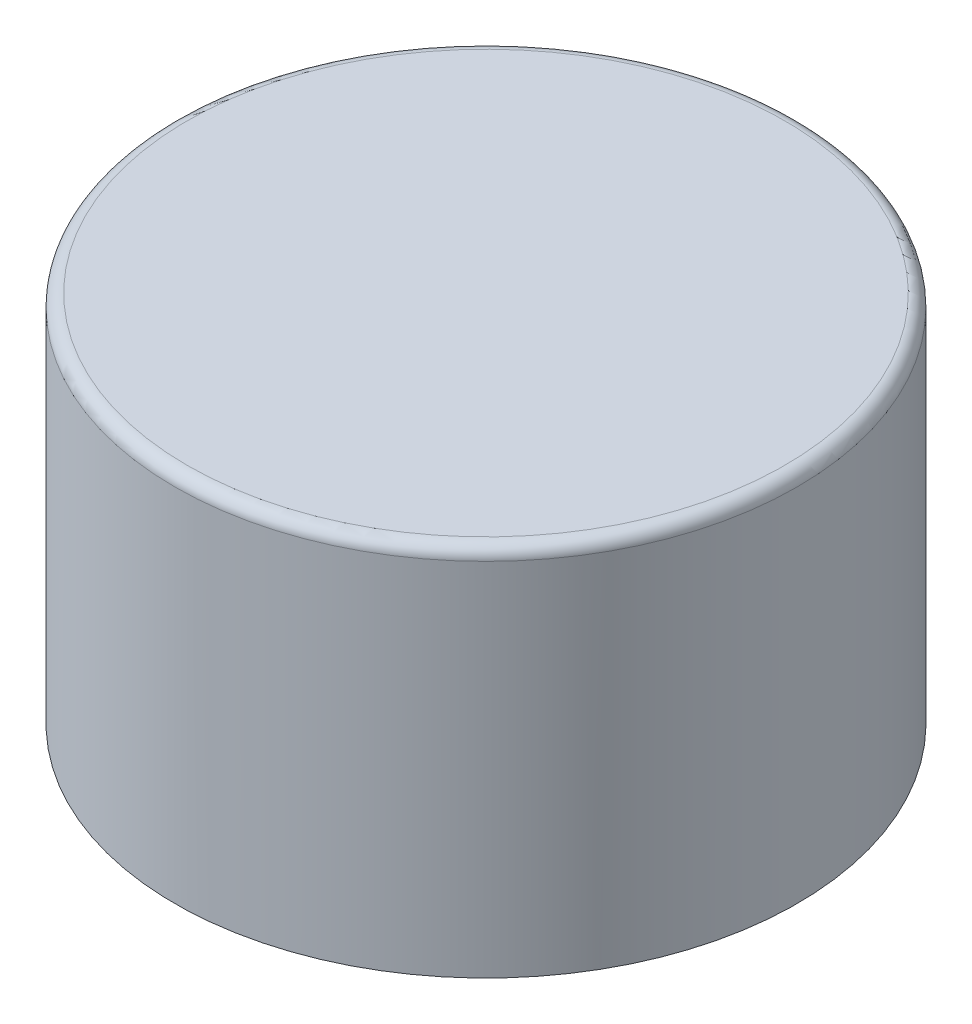
from build123d import *

# Parameters (mm, degrees)
SKETCH1_R           = 63.5
BOSS_EXTRUDE1_DEPTH = 76.2
SHELL1_T            = -6.35
FILLET1_R           = 2.54


with BuildPart() as part:
    # Sketch1 → Boss-Extrude1 (new body)
    with BuildSketch(Plane(origin=(0, 0, 0), x_dir=(1, 0, 0), z_dir=(0, 1, 0))):
        with Locations(Location((0, 0, 0), (0, 0, 90))):
            Circle(SKETCH1_R)
    extrude(amount=BOSS_EXTRUDE1_DEPTH)

    # Shell1
    shell1_openings = [part.faces().sort_by_distance(p)[0] for p in [
        (0, 0, 0),
    ]]
    offset(amount=SHELL1_T, openings=shell1_openings, kind=Kind.INTERSECTION)

    # Fillet1
    fillet1_edges = [part.edges().sort_by_distance(p)[0] for p in [
        (0, 76.2, 63.5),
    ]]
    fillet(fillet1_edges, radius=FILLET1_R)


solid = part.part
